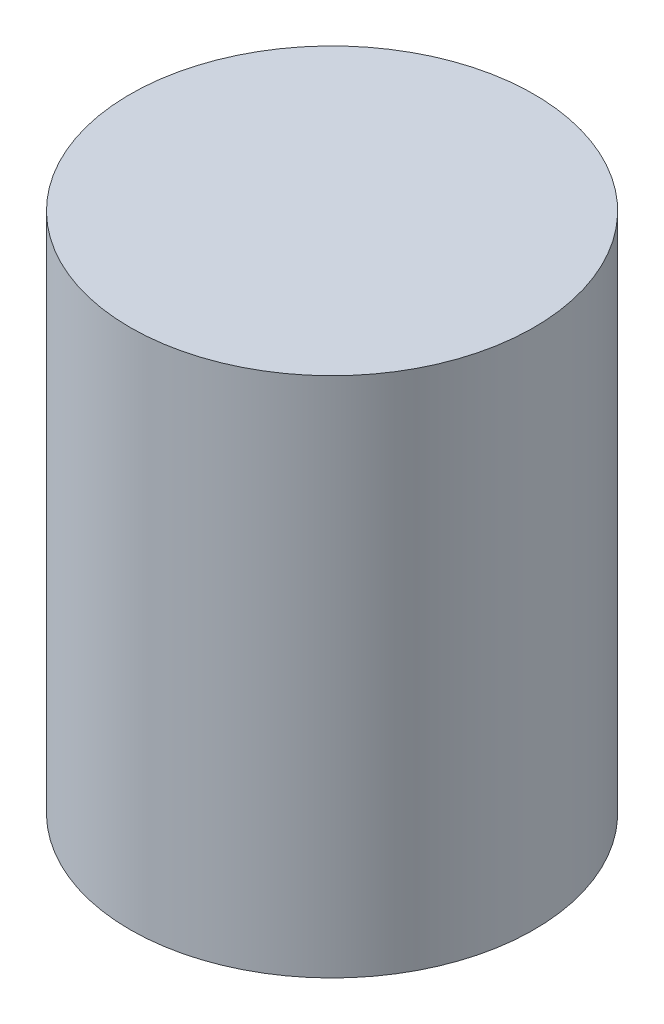
from build123d import *

# Parameters (mm, degrees)
SKETCH1_R           = 3.485
BOSS_EXTRUDE1_DEPTH = 9


with BuildPart() as part:
    # Sketch1 → Boss-Extrude1 (new body)
    with BuildSketch(Plane(origin=(0, 0, 0), x_dir=(1, 0, 0), z_dir=(0, 1, 0))):
        with Locations(Location((0, 0, 0), (0, 0, 270))):
            Circle(SKETCH1_R)
    extrude(amount=BOSS_EXTRUDE1_DEPTH)


solid = part.part
